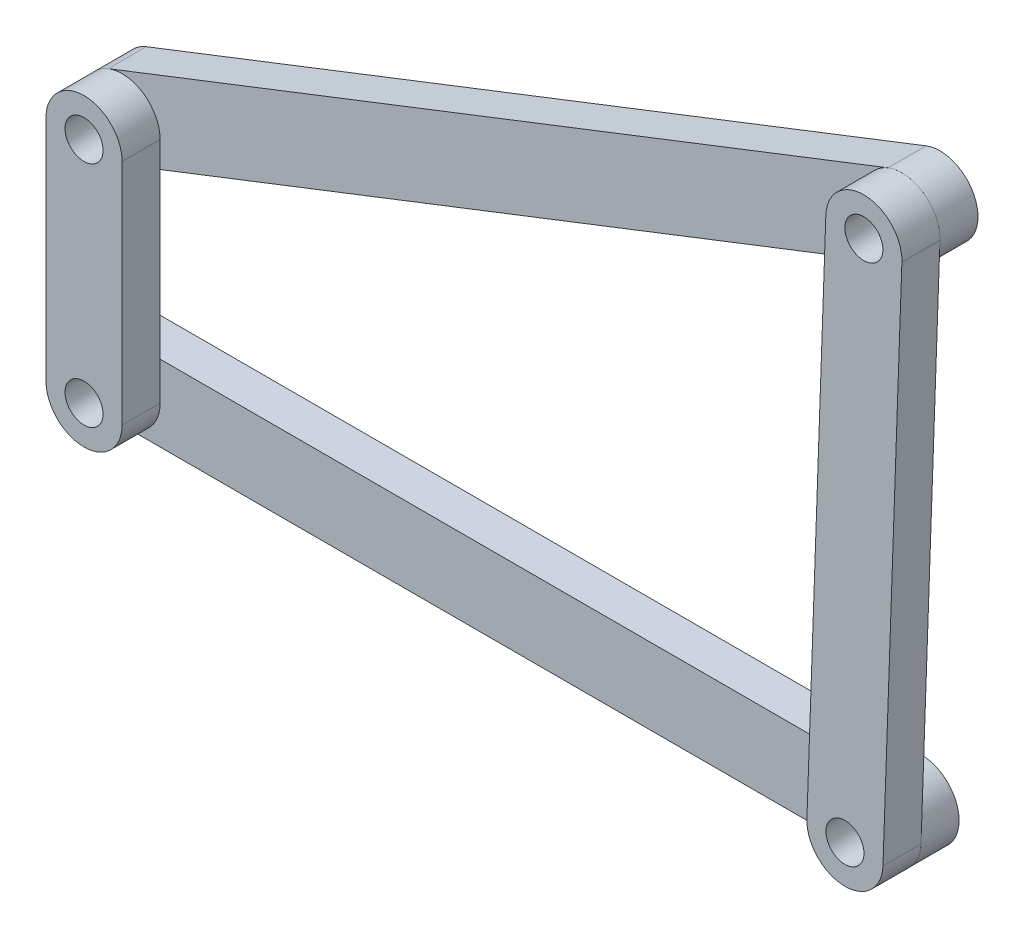
from build123d import *

# Parameters (mm, degrees)
SKETCH_2_R      = 2.5
EXTRUDE_1_DEPTH = 5
SKETCH_3_R      = 2.5
EXTRUDE_2_DEPTH = 5
SKETCH_4_R      = 2.5
EXTRUDE_3_DEPTH = 5
SKETCH_5_R      = 2.5
EXTRUDE_4_DEPTH = 5


with BuildPart() as part:
    # 草图2 → 凸台-拉伸1 (new body)
    with BuildSketch(Plane.XY):
        with BuildLine():
            Line((0, 5), (100, 5))
            ThreePointArc((100, 5), (105, 0), (100, -5))
            Line((100, -5), (0, -5))
            ThreePointArc((0, -5), (-5, 0), (0, 5))
        make_face()
        Circle(SKETCH_2_R, mode=Mode.SUBTRACT)
        with Locations((100, 0)):
            Circle(SKETCH_2_R, mode=Mode.SUBTRACT)
    extrude(amount=EXTRUDE_1_DEPTH)


with BuildPart() as body_2:
    # 草图3 → 凸台-拉伸2 (new body)
    with BuildSketch(Plane.XY.offset(5)):
        with BuildLine():
            Line((-5, 0), (-5, 30))
            ThreePointArc((-5, 30), (0, 35), (5, 30))
            Line((5, 30), (5, 0))
            ThreePointArc((5, 0), (0, -5), (-5, 0))
        make_face()
        Circle(SKETCH_3_R, mode=Mode.SUBTRACT)
        with Locations((0, 30)):
            Circle(SKETCH_3_R, mode=Mode.SUBTRACT)
    extrude(amount=EXTRUDE_2_DEPTH)


with BuildPart() as body_3:
    # 草图4 → 凸台-拉伸3 (new body)
    with BuildSketch(Plane(origin=(0, 0, 5), x_dir=(-1, 0, 0), z_dir=(0, 0, -1))):
        with BuildLine():
            Line((-1.816173425, 25.341511609), (-104.30291803, 65.297326959))
            ThreePointArc((-104.30291803, 65.297326959), (-107.145232996, 71.771988775), (-100.67057118, 74.614303741))
            Line((-100.67057118, 74.614303741), (1.816173425, 34.658488391))
            ThreePointArc((1.816173425, 34.658488391), (4.658488391, 28.183826575), (-1.816173425, 25.341511609))
        make_face()
        with Locations((0, 30)):
            Circle(SKETCH_4_R, mode=Mode.SUBTRACT)
        with Locations((-102.486744605, 69.95581535)):
            Circle(SKETCH_4_R, mode=Mode.SUBTRACT)
    extrude(amount=EXTRUDE_3_DEPTH)


with BuildPart() as body_4:
    # 草图5 → 凸台-拉伸4 (new body)
    with BuildSketch(Plane.XY.offset(5)):
        with BuildLine():
            Line((107.483588559, 69.778190735), (104.996843954, -0.177624615))
            ThreePointArc((104.996843954, -0.177624615), (99.822375385, -4.996843954), (95.003156046, 0.177624615))
            Line((95.003156046, 0.177624615), (97.489900651, 70.133439965))
            ThreePointArc((97.489900651, 70.133439965), (102.66436922, 74.952659303), (107.483588559, 69.778190735))
        make_face()
        with Locations((100, 0)):
            Circle(SKETCH_5_R, mode=Mode.SUBTRACT)
        with Locations(Location((102.486744605, 69.95581535, 0), (0, 0, 180))):
            Circle(SKETCH_5_R, mode=Mode.SUBTRACT)
    extrude(amount=EXTRUDE_4_DEPTH)


solid = Compound([part.part, body_2.part, body_3.part, body_4.part])
